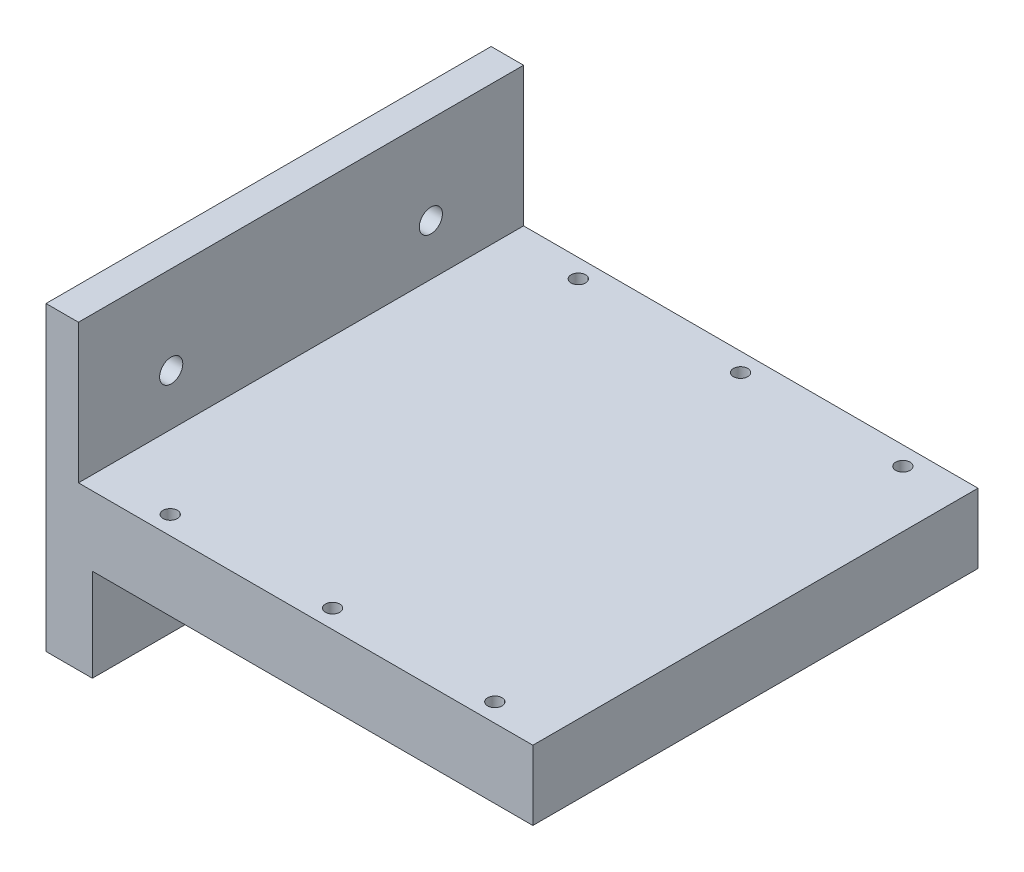
from build123d import *

# Parameters (mm, degrees)
SKIZZE1_W                       = 105
SKIZZE1_H                       = 15
AUFSATZ_LINEAR_AUSTRAGEN1_DEPTH = 96
SKIZZE3_W                       = 7
SKIZZE3_H                       = 96
AUFSATZ_LINEAR_AUSTRAGEN2_DEPTH = 30
SKIZZE4_W                       = 10
SKIZZE4_H                       = 96
AUFSATZ_LINEAR_AUSTRAGEN3_DEPTH = 20
SKIZZE5_R                       = 1.55
SCHNITT_LINEAR_AUSTRAGEN1_DEPTH = 20
SKIZZE6_R                       = 2.5
SCHNITT_LINEAR_AUSTRAGEN2_DEPTH = 20


with BuildPart() as part:
    # Skizze1 → Aufsatz-Linear austragen1 (new body)
    with BuildSketch(Plane.XY):
        Rectangle(SKIZZE1_W, SKIZZE1_H)
    extrude(amount=AUFSATZ_LINEAR_AUSTRAGEN1_DEPTH)

    # Skizze3 → Aufsatz-Linear austragen2 (add)
    with BuildSketch(Plane(origin=(0, 7.5, 0), x_dir=(1, 0, 0), z_dir=(0, 1, 0))):
        with Locations((-49, -48)):
            Rectangle(SKIZZE3_W, SKIZZE3_H)
    extrude(amount=AUFSATZ_LINEAR_AUSTRAGEN2_DEPTH)

    # Skizze4 → Aufsatz-Linear austragen3 (add)
    with BuildSketch(Plane.XZ.offset(7.5)):
        with Locations((-47.5, 48)):
            Rectangle(SKIZZE4_W, SKIZZE4_H)
    extrude(amount=AUFSATZ_LINEAR_AUSTRAGEN3_DEPTH)

    # Skizze5 → Schnitt-Linear austragen1 (cut)
    with BuildSketch(Plane(origin=(0, 7.5, 0), x_dir=(1, 0, 0), z_dir=(0, 1, 0))):
        with Locations(Location((40.3, -92, 0), (0, 0, 270))):
            Circle(SKIZZE5_R)
        with Locations(Location((40.3, -4, 0), (0, 0, 270))):
            Circle(SKIZZE5_R)
        with Locations(Location((5.3, -4, 0), (0, 0, 270))):
            Circle(SKIZZE5_R)
        with Locations(Location((5.3, -92, 0), (0, 0, 270))):
            Circle(SKIZZE5_R)
        with Locations(Location((-29.7, -4, 0), (0, 0, 270))):
            Circle(SKIZZE5_R)
        with Locations(Location((-29.7, -92, 0), (0, 0, 270))):
            Circle(SKIZZE5_R)
    extrude(amount=-SCHNITT_LINEAR_AUSTRAGEN1_DEPTH, mode=Mode.SUBTRACT)

    # Skizze6 → Schnitt-Linear austragen2 (cut)
    with BuildSketch(Plane(origin=(-42.5, 0, 0), x_dir=(0, 0, -1), z_dir=(1, 0, 0))):
        with Locations((-76, -19.5)):
            Circle(SKIZZE6_R)
        with Locations((-20, -19.5)):
            Circle(SKIZZE6_R)
    schnitt_linear_austragen2 = extrude(amount=-SCHNITT_LINEAR_AUSTRAGEN2_DEPTH, mode=Mode.SUBTRACT)

    # Spiegeln1: Schnitt-Linear austragen2 across plane
    add(schnitt_linear_austragen2.mirror(Plane.ZX.offset(-0.5)), mode=Mode.SUBTRACT)


solid = part.part
